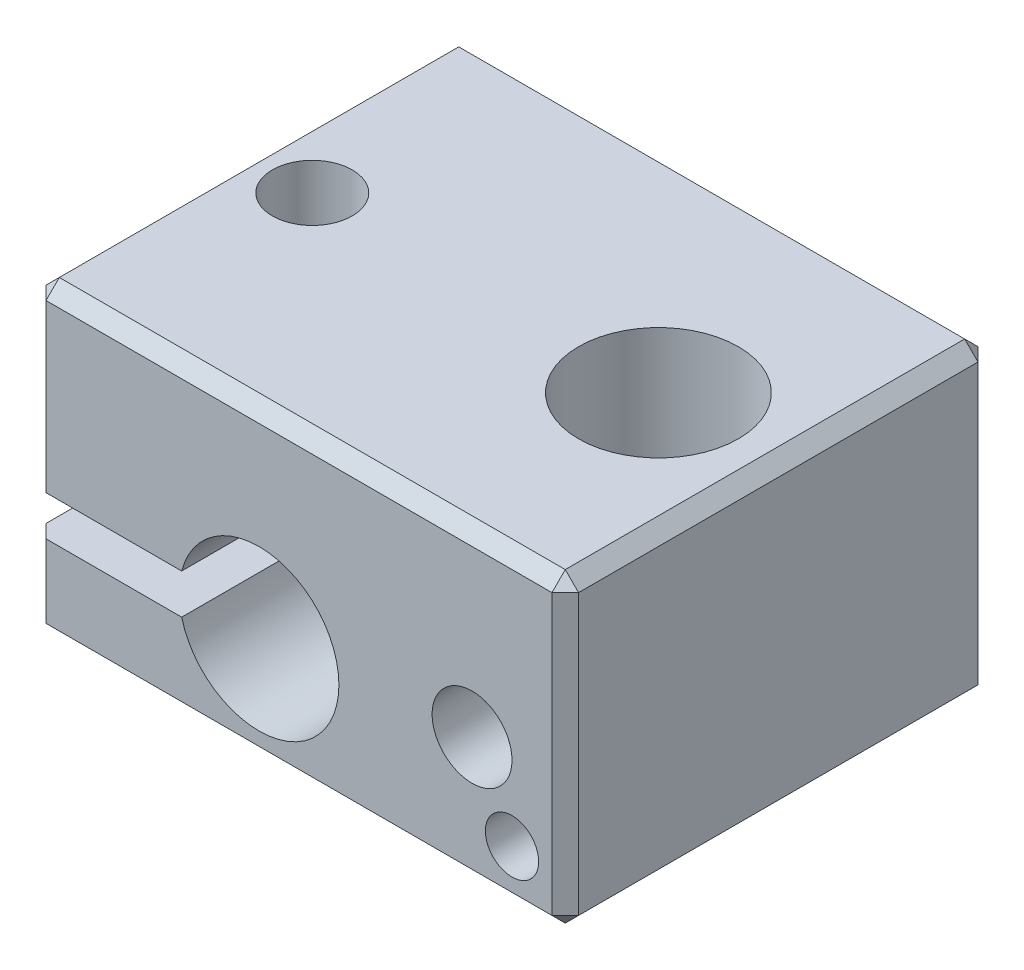
from build123d import *

# Parameters (mm, degrees)
SKETCH1_W                   = 20
SKETCH1_H                   = 16
BOSS_EXTRUDE1_DEPTH         = 11.5
CUT_EXTRUDE1_DEPTH          = 23.096379794
M3_TAPPED_HOLE1_D           = 2.5
M3_TAPPED_HOLE1_DEPTH       = 3.5
M3_TAPPED_HOLE1_CBORE_D     = 3
M3_TAPPED_HOLE1_CBORE_DEPTH = 3
M3_TAPPED_HOLE1_TIP         = 0.751075774
HOLE1_D                     = 1.5
HOLE1_DEPTH                 = 4.5
HOLE1_CBORE_D               = 2
HOLE1_CBORE_DEPTH           = 2
M6_TAPPED_HOLE1_D           = 6
M3_TAPPED_HOLE2_D           = 3
CHAMFER1_SIZE               = 0.5


with BuildPart() as part:
    # Sketch1 → Boss-Extrude1 (new body)
    with BuildSketch(Plane(origin=(0, 0, 0), x_dir=(1, 0, 0), z_dir=(0, 1, 0))):
        Rectangle(SKETCH1_W, SKETCH1_H)
    extrude(amount=BOSS_EXTRUDE1_DEPTH)

    # Sketch2 → Cut-Extrude1 (cut, through all)
    with BuildSketch(Plane.XY.offset(8)):
        with BuildLine():
            Line((-4.40473751, 4.75), (-10, 4.75))
            Line((-10, 4.75), (-10, 4))
            Line((-10, 4), (-10, 3.25))
            Line((-10, 3.25), (-4.40473751, 3.25))
            ThreePointArc((-4.40473751, 3.25), (1.5, 4), (-4.40473751, 4.75))
        make_face()
    extrude(amount=-CUT_EXTRUDE1_DEPTH, mode=Mode.SUBTRACT)

    # M3 Tapped Hole1
    with Locations(Plane.XY.offset(8)):
        with Locations((6.5, 4.8)):
            CounterBoreHole(M3_TAPPED_HOLE1_D / 2, M3_TAPPED_HOLE1_CBORE_D / 2, M3_TAPPED_HOLE1_CBORE_DEPTH, depth=M3_TAPPED_HOLE1_DEPTH)
            with Locations((0, 0, -(M3_TAPPED_HOLE1_DEPTH + M3_TAPPED_HOLE1_TIP / 2))):  # 118° drill point
                Cone(0, M3_TAPPED_HOLE1_D / 2, M3_TAPPED_HOLE1_TIP, mode=Mode.SUBTRACT)

    # Hole1
    with Locations(Plane.XY.offset(8)):
        with Locations((8, 2)):
            CounterBoreHole(HOLE1_D / 2, HOLE1_CBORE_D / 2, HOLE1_CBORE_DEPTH, depth=HOLE1_DEPTH)

    # M6 Tapped Hole1 (through all)
    with Locations(Plane(origin=(0, 11.5, 0), x_dir=(1, 0, 0), z_dir=(0, 1, 0))):
        with Locations((5.5, 0)):
            Hole(M6_TAPPED_HOLE1_D / 2)

    # M3 Tapped Hole2 (through all)
    with Locations(Plane(origin=(0, 11.5, 0), x_dir=(1, 0, 0), z_dir=(0, 1, 0))):
        with Locations((-7.5, 0)):
            Hole(M3_TAPPED_HOLE2_D / 2)

    # Chamfer1
    chamfer1_edges = [part.edges().sort_by_distance(p)[0] for p in [
        (-10, 11.5, 0),
        (0, 11.5, 8),
        (-10, 1.625, 8),
        (-10, 1.625, -8),
        (10, 11.5, 0),
        (0, 0, 8),
        (-10, 0, 0),
        (0, 0, -8),
        (10, 0, 0),
        (0, 11.5, -8),
        (10, 5.75, 8),
        (-10, 8.125, 8),
        (-10, 8.125, -8),
        (10, 5.75, -8),
    ]]
    chamfer(chamfer1_edges, length=CHAMFER1_SIZE)


solid = part.part
